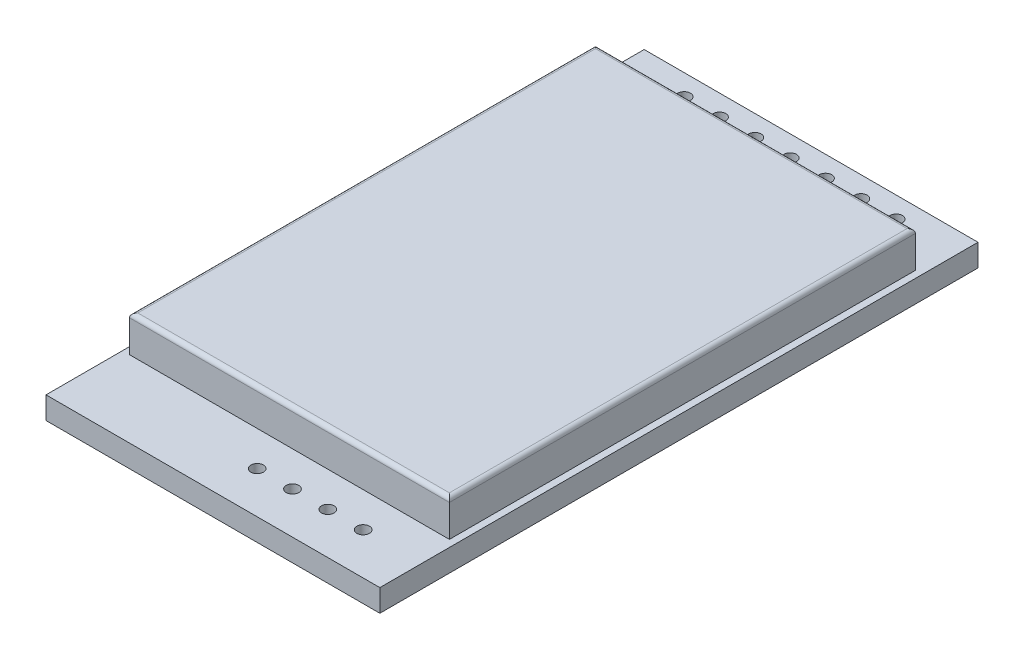
from build123d import *

# Parameters (mm, degrees)
SKETCH1_W           = 24
SKETCH1_H           = 43
SKETCH1_R           = 0.45
BOSS_EXTRUDE1_DEPTH = 1.6
SKETCH2_W           = 23
SKETCH2_H           = 33.5
BOSS_EXTRUDE2_DEPTH = 2.6
FILLET1_R           = 0.3


with BuildPart() as part:
    # Sketch1 → Boss-Extrude1 (new body)
    with BuildSketch(Plane(origin=(0, 0, 0), x_dir=(1, 0, 0), z_dir=(0, 1, 0))):
        with Locations((12, 21.5)):
            Rectangle(SKETCH1_W, SKETCH1_H)
        with Locations(Location((19.62, 41.5, 0), (0, 0, 270))):
            Circle(SKETCH1_R, mode=Mode.SUBTRACT)
        with Locations(Location((17.08, 41.5, 0), (0, 0, 270))):
            Circle(SKETCH1_R, mode=Mode.SUBTRACT)
        with Locations(Location((14.54, 41.5, 0), (0, 0, 270))):
            Circle(SKETCH1_R, mode=Mode.SUBTRACT)
        with Locations(Location((12, 41.5, 0), (0, 0, 270))):
            Circle(SKETCH1_R, mode=Mode.SUBTRACT)
        with Locations(Location((9.46, 41.5, 0), (0, 0, 270))):
            Circle(SKETCH1_R, mode=Mode.SUBTRACT)
        with Locations(Location((6.92, 41.5, 0), (0, 0, 270))):
            Circle(SKETCH1_R, mode=Mode.SUBTRACT)
        with Locations(Location((4.38, 41.5, 0), (0, 0, 270))):
            Circle(SKETCH1_R, mode=Mode.SUBTRACT)
        with Locations(Location((19.8, 3, 0), (0, 0, 270))):
            Circle(SKETCH1_R, mode=Mode.SUBTRACT)
        with Locations(Location((17.26, 3, 0), (0, 0, 270))):
            Circle(SKETCH1_R, mode=Mode.SUBTRACT)
        with Locations(Location((14.72, 3, 0), (0, 0, 270))):
            Circle(SKETCH1_R, mode=Mode.SUBTRACT)
        with Locations(Location((12.18, 3, 0), (0, 0, 270))):
            Circle(SKETCH1_R, mode=Mode.SUBTRACT)
    extrude(amount=BOSS_EXTRUDE1_DEPTH)

    # Sketch2 → Boss-Extrude2 (add)
    with BuildSketch(Plane(origin=(0, 1.6, 0), x_dir=(1, 0, 0), z_dir=(0, 1, 0))):
        with Locations((12, 22.25)):
            Rectangle(SKETCH2_W, SKETCH2_H)
    extrude(amount=BOSS_EXTRUDE2_DEPTH)

    # Fillet1
    fillet1_edges = [part.edges().sort_by_distance(p)[0] for p in [
        (0.5, 4.2, -22.25),
        (12, 4.2, -5.5),
        (23.5, 4.2, -22.25),
        (12, 4.2, -39),
    ]]
    fillet(fillet1_edges, radius=FILLET1_R)


solid = part.part
